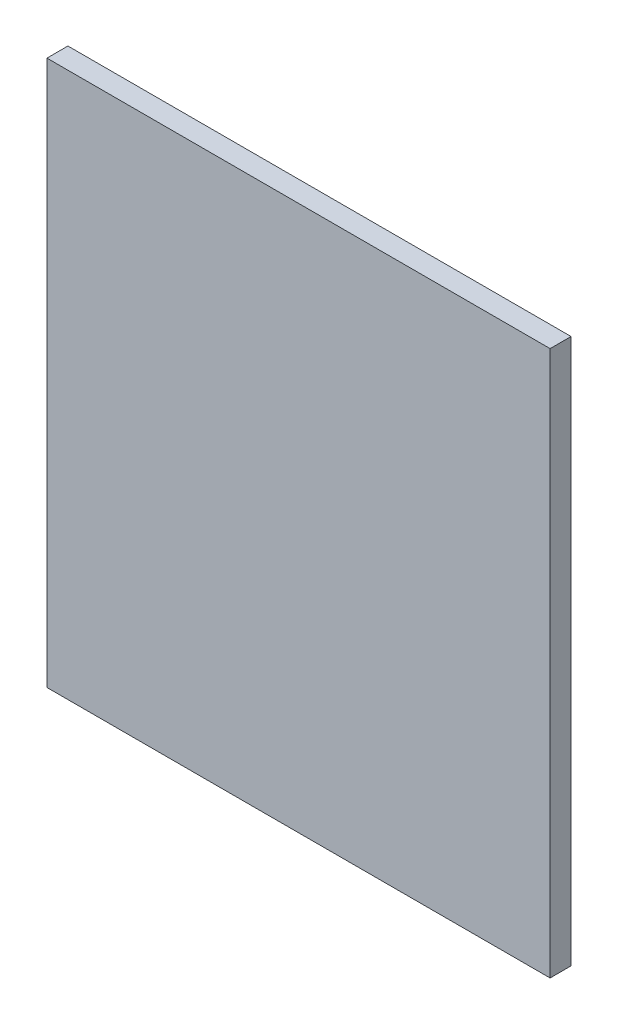
from build123d import *

# Parameters (mm, degrees)
SKETCH_1_W      = 12
SKETCH_1_H      = 13
EXTRUDE_1_DEPTH = 0.5


with BuildPart() as part:
    # 草圖1 → 填料-伸長1 (new body)
    with BuildSketch(Plane.XY):
        Rectangle(SKETCH_1_W, SKETCH_1_H)
    extrude(amount=EXTRUDE_1_DEPTH)


solid = part.part
